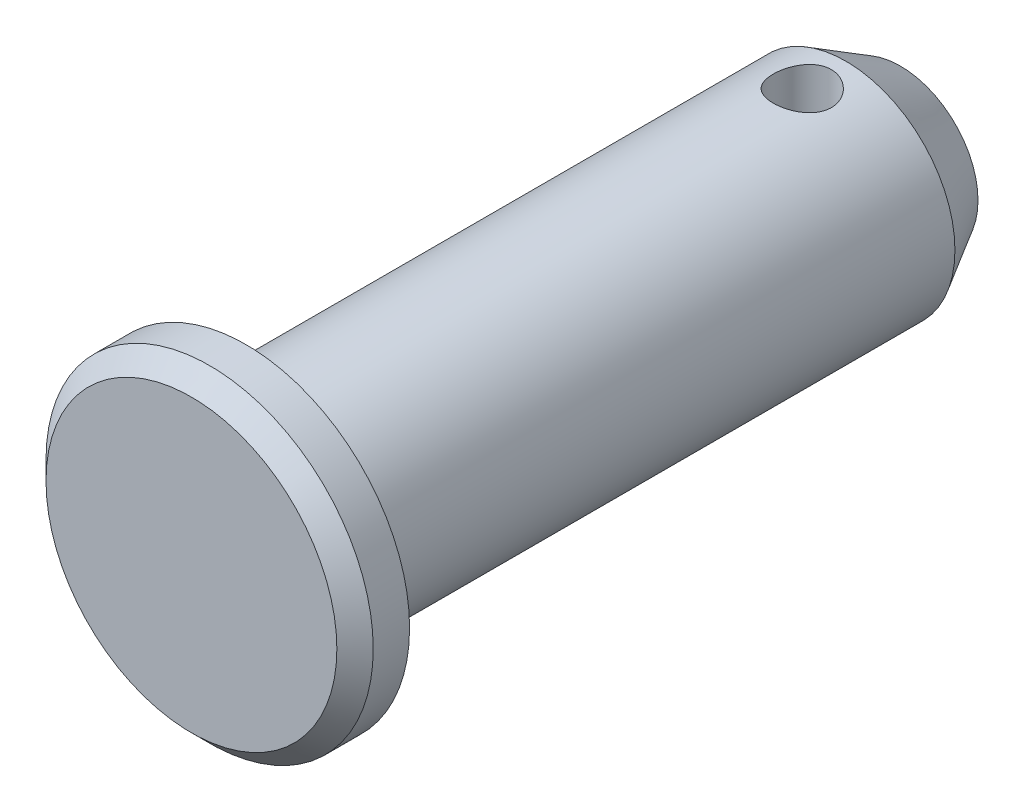
from build123d import *

# Parameters (mm, degrees)
WYTNIJ_WYCI_GNI_CIE1_DEPTH      = 12.643131022
WYTNIJ_WYCI_GNI_CIE1_DEPTH_BACK = 12.643131022
SZKIC2_R                        = 0.8


with BuildPart() as part:
    # Szkic1 → Obrót1 (revolve)
    with BuildSketch(Plane(origin=(0, 0, 0), x_dir=(1, 0, 0), z_dir=(0, 1, 0))):
        Polygon((0, -9.75), (4, -9.75), (4.5, -9.25), (4.5, -8.25), (3, -8.25), (3, 8.25), (2.133974596, 9.75), (0, 9.75), align=None)
    revolve(axis=Axis((0, 0, 9.75), (0, 0, -1)))

    # Szkic2 → Wytnij-wyciągnięcie1 (cut, two sides: drawn at the far end of the back side and taken through both)
    with BuildSketch(Plane(origin=(0, 0, 0), x_dir=(1, 0, 0), z_dir=(0, 1, 0)).offset(-WYTNIJ_WYCI_GNI_CIE1_DEPTH_BACK)):
        with Locations(Location((0, 7.05, 0), (0, 0, 270))):
            Circle(SZKIC2_R)
    extrude(amount=WYTNIJ_WYCI_GNI_CIE1_DEPTH + WYTNIJ_WYCI_GNI_CIE1_DEPTH_BACK, mode=Mode.SUBTRACT)


solid = part.part
